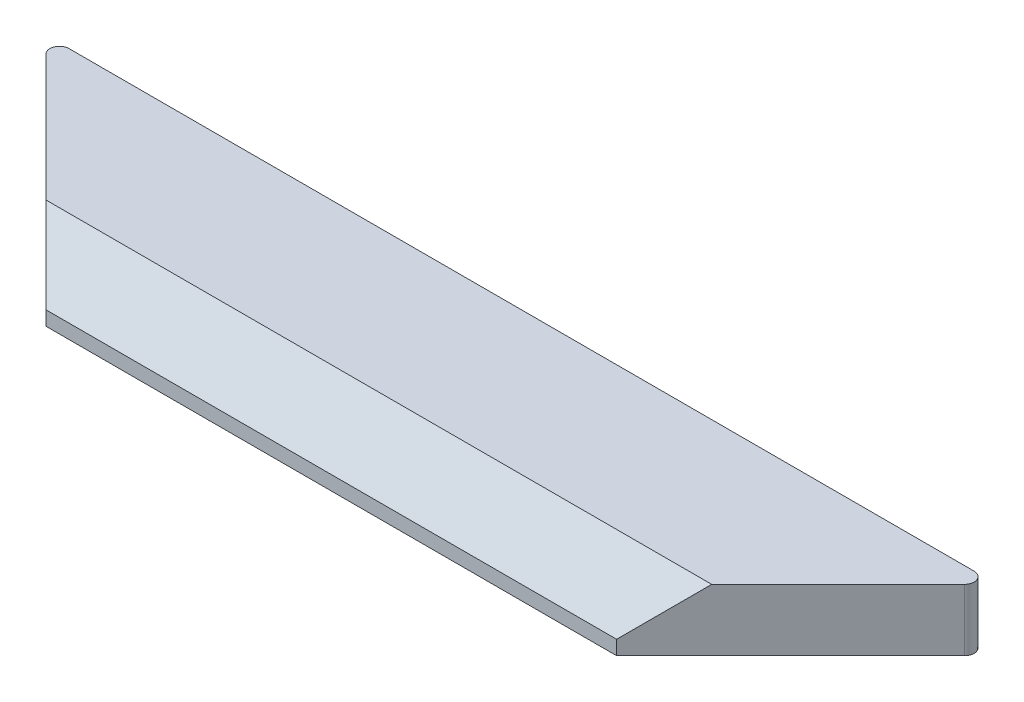
from build123d import *

# Parameters (mm, degrees)
BOSS_EXTRUDE1_DEPTH = 3.25
SKETCH2_W           = 60
SKETCH2_H           = 10
CUT_EXTRUDE1_DEPTH  = 4
CHAMFER1_SIZE       = 5
FILLET1_R           = 1


with BuildPart() as part:
    # Sketch1 → Boss-Extrude1 (new, symmetric)
    with BuildSketch(Plane(origin=(0, 0, 0), x_dir=(1, 0, 0), z_dir=(0, 1, 0))):
        Polygon((-50, 10), (-30, -10), (30, -10), (50, 10), align=None)
    extrude(amount=BOSS_EXTRUDE1_DEPTH, both=True)

    # Sketch2 → Cut-Extrude1 (cut)
    with BuildSketch(Plane.XZ.offset(3.25)):
        with Locations((0, -5)):
            Rectangle(SKETCH2_W, SKETCH2_H)
    extrude(amount=-CUT_EXTRUDE1_DEPTH, mode=Mode.SUBTRACT)

    # Sketch3 → Cut-Revolve1 (revolve, cut)
    with BuildSketch(Plane(origin=(-30, 0, 0), x_dir=(0, 0, -1), z_dir=(1, 0, 0))):
        with BuildLine():
            Line((5, -0.25), (5, -2.25))
            ThreePointArc((5, -2.25), (6, -1.25), (5, -0.25))
        make_face()
    revolve(axis=Axis((-30, -0.25, -5), (0, -1, 0)), mode=Mode.SUBTRACT)

    # Sketch4 → Cut-Revolve2 (revolve, cut)
    with BuildSketch(Plane.ZY.offset(-30)):
        with BuildLine():
            Line((-5, -0.25), (-5, -2.25))
            ThreePointArc((-5, -2.25), (-6, -1.25), (-5, -0.25))
        make_face()
    revolve(axis=Axis((30, 0.75, -5), (0, -1, 0)), mode=Mode.SUBTRACT)

    # Chamfer1
    chamfer1_edges = [part.edges().sort_by_distance(p)[0] for p in [
        (0, 3.25, 10),
    ]]
    chamfer(chamfer1_edges, length=CHAMFER1_SIZE)

    # Fillet1
    fillet1_edges = [part.edges().sort_by_distance(p)[0] for p in [
        (-30, -1.25, -10),
        (-30, -1.25, 0),
        (30, -1.25, 0),
        (30, -1.25, -10),
        (-50, 0, -10),
        (50, 0, -10),
    ]]
    fillet(fillet1_edges, radius=FILLET1_R)


solid = part.part
